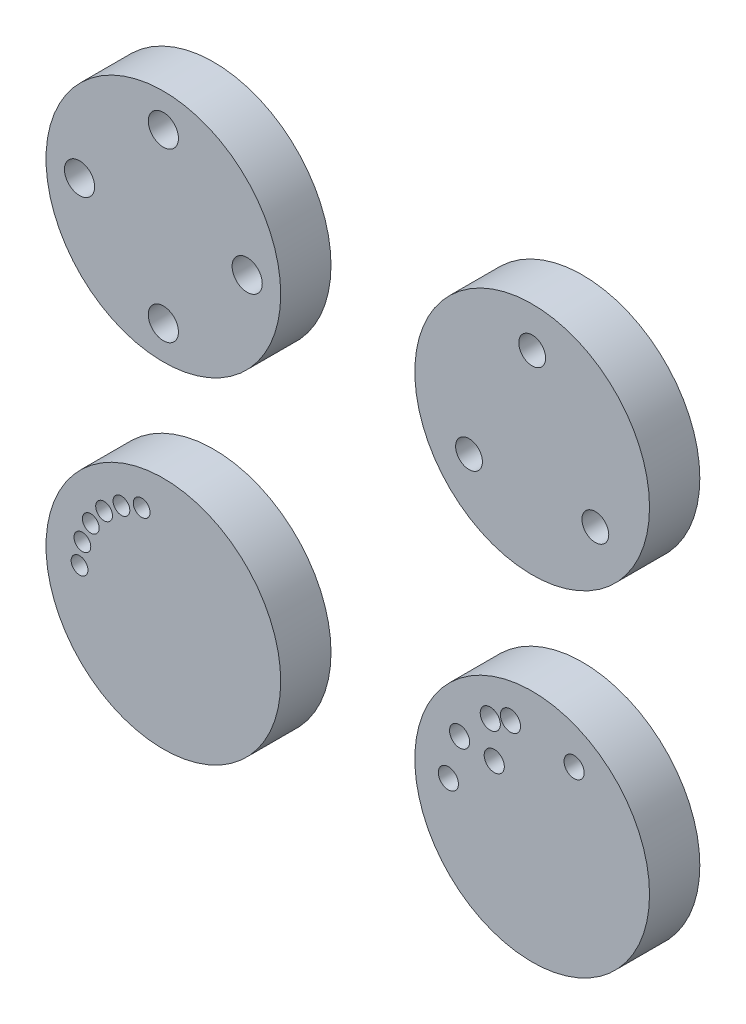
from build123d import *

# Parameters (mm, degrees)
SKETCH_1_R               = 35
EXTRUDE_1_DEPTH          = 15
SKETCH_2_R               = 4.5
CUT_EXTRUDE_1_DEPTH      = 52.720402164
PATTERN_CIRCULAR_1_COUNT = 4
SKETCH_3_R               = 35
EXTRUDE_2_DEPTH          = 15
SKETCH_4_R               = 4
CUT_EXTRUDE_2_DEPTH      = 15
SKETCH_5_R               = 35
EXTRUDE_3_DEPTH          = 15
SKETCH_6_R               = 2.5
CUT_EXTRUDE_3_DEPTH      = 10
PATTERN_CIRCULAR_2_COUNT = 6
PATTERN_CIRCULAR_2_ANGLE = 75
SKETCH_7_R               = 35
EXTRUDE_4_DEPTH          = 15
SKETCH_8_R               = 3
CUT_EXTRUDE_4_DEPTH      = 10


with BuildPart() as part:
    # Эскиз1 → Бобышка-Вытянуть1 (new body)
    with BuildSketch(Plane.XY):
        Circle(SKETCH_1_R)
    extrude(amount=EXTRUDE_1_DEPTH)

    # Эскиз2 → Вырез-Вытянуть1 (cut, through all)
    with BuildSketch(Plane.XY.offset(15)):
        with Locations((0, 25)):
            Circle(SKETCH_2_R)
    cut_extrude_1 = extrude(amount=-CUT_EXTRUDE_1_DEPTH, mode=Mode.SUBTRACT)

    # Круговой массив1: Вырез-Вытянуть1 ×4 about axis
    pattern_circular_1_axis = Axis((0, 0, 0), (0, 0, 1))
    for i in range(1, PATTERN_CIRCULAR_1_COUNT):
        add(cut_extrude_1.rotate(pattern_circular_1_axis, i * 360 / PATTERN_CIRCULAR_1_COUNT), mode=Mode.SUBTRACT)


with BuildPart() as body_2:
    # Эскиз3 → Бобышка-Вытянуть2 (new body)
    with BuildSketch(Plane.XY):
        with Locations((110, 0)):
            Circle(SKETCH_3_R)
    extrude(amount=EXTRUDE_2_DEPTH)

    # Эскиз4 → Вырез-Вытянуть2 (cut)
    with BuildSketch(Plane.XY.offset(15)):
        with Locations((110, 23)):
            Circle(SKETCH_4_R)
        with Locations((128.840497019, -13.192258036)):
            Circle(SKETCH_4_R)
        with Locations((91.159502981, -13.192258036)):
            Circle(SKETCH_4_R)
    extrude(amount=-CUT_EXTRUDE_2_DEPTH, mode=Mode.SUBTRACT)


with BuildPart() as body_3:
    # Эскиз5 → Бобышка-Вытянуть3 (new body)
    with BuildSketch(Plane.XY):
        with Locations((0, -100)):
            Circle(SKETCH_5_R)
    extrude(amount=EXTRUDE_3_DEPTH)

    # Эскиз6 → Вырез-Вытянуть3 (cut)
    with BuildSketch(Plane.XY.offset(15)):
        with Locations((-25, -100)):
            Circle(SKETCH_6_R)
    cut_extrude_3 = extrude(amount=-CUT_EXTRUDE_3_DEPTH, mode=Mode.SUBTRACT)

    # Круговой массив2: Вырез-Вытянуть3 ×6 about axis
    pattern_circular_2_axis = Axis((0, -100, 0), (0, 0, -1))
    for i in range(1, PATTERN_CIRCULAR_2_COUNT):
        add(cut_extrude_3.rotate(pattern_circular_2_axis, i * PATTERN_CIRCULAR_2_ANGLE / (PATTERN_CIRCULAR_2_COUNT - 1)), mode=Mode.SUBTRACT)


with BuildPart() as body_4:
    # Эскиз7 → Бобышка-Вытянуть4 (new body)
    with BuildSketch(Plane.XY):
        with Locations((110, -100)):
            Circle(SKETCH_7_R)
    extrude(amount=EXTRUDE_4_DEPTH)

    # Эскиз8 → Вырез-Вытянуть4 (cut)
    with BuildSketch(Plane.XY.offset(15)):
        with Locations((85, -100)):
            Circle(SKETCH_8_R)
        with Locations((88.349364905, -87.5)):
            Circle(SKETCH_8_R)
        with Locations((97.5, -78.349364905)):
            Circle(SKETCH_8_R)
        with Locations((103.529523872, -75.851854343)):
            Circle(SKETCH_8_R)
        with Locations((98.686291501, -88.686291501)):
            Circle(SKETCH_8_R)
        with Locations((122.5, -78.349364905)):
            Circle(SKETCH_8_R)
    extrude(amount=-CUT_EXTRUDE_4_DEPTH, mode=Mode.SUBTRACT)


solid = Compound([part.part, body_2.part, body_3.part, body_4.part])
